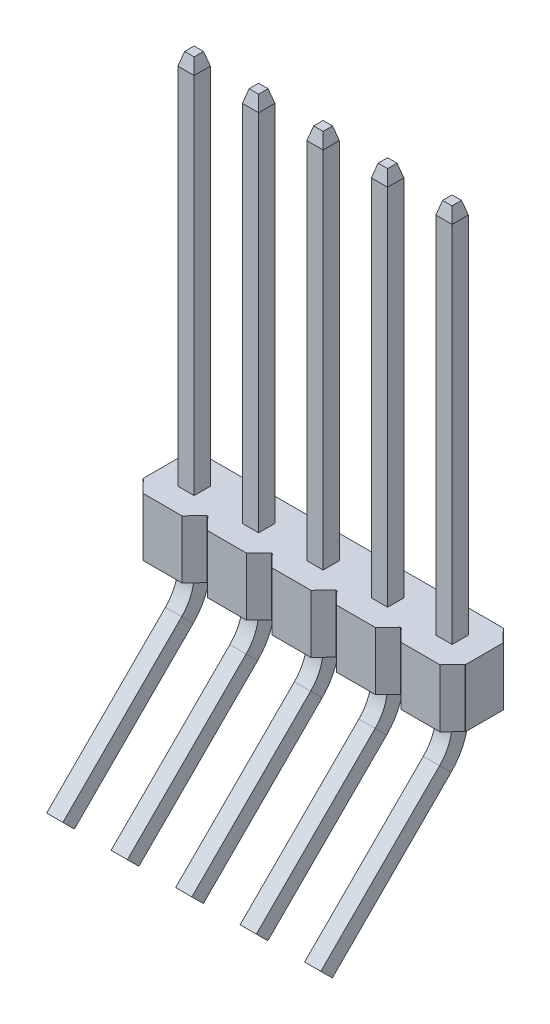
from build123d import *
from OCP.BRepFilletAPI import BRepFilletAPI_MakeChamfer

# Parameters (mm, degrees)
BOSS_EXTRUDE1_DEPTH         = 2.29
SKETCH3_W                   = 0.64
SKETCH3_H                   = 0.64
CHAMFER3_SIZE               = 0.5
CHAMFER3_SIZE2              = 0.133974596
LPATTERN1_COUNT             = 5
LPATTERN1_PITCH             = 2.54
CHAMFER3_OF_LPATTERN1_SIZE  = 0.5
CHAMFER3_OF_LPATTERN1_SIZE2 = 0.133974596


with BuildPart() as part:
    # Sketch1 → Boss-Extrude1 (new body)
    with BuildSketch(Plane(origin=(0, 0, 0), x_dir=(1, 0, 0), z_dir=(0, 1, 0))):
        Polygon((-0.77, 1.25), (0.77, 1.25), (1.25, 0.75), (1.27, 0.75), (1.27, -0.75), (1.25, -0.75), (0.77, -1.25), (-0.77, -1.25), (-1.25, -0.75), (-1.27, -0.75), (-1.27, 0.75), (-1.25, 0.75), align=None)
    boss_extrude1 = extrude(amount=BOSS_EXTRUDE1_DEPTH)

    # Sweep1: sweep along a path in Sketch2
    with BuildLine(Plane(origin=(0, 0, 0), x_dir=(0, 0, -1), z_dir=(1, 0, 0))) as sweep1_path:
        Line((0, 17.12), (0, -0.408142235))
        ThreePointArc((0, -0.408142235), (-0.152240935, -1.1735091), (-0.585786438, -1.822355798))
        Line((-0.585786438, -1.822355798), (-5.26343064, -6.5))
    # Sketch3 → Sweep1 (sweep)
    with BuildSketch(Plane(origin=(0, 17.12, 0), x_dir=(1, 0, 0), z_dir=(0, 1, 0))):
        Rectangle(SKETCH3_W, SKETCH3_H)
    sweep1 = sweep(path=sweep1_path.line)

    # Chamfer3: one chamfer whose edges measure the first distance from different faces: ONE call of the kernel's chamfer builder (chamfer() names one face for all edges)
    chamfer3_edges_1 = [part.edges().sort_by_distance(p)[0] for p in [
        (0.32, 17.12, 0),
    ]]
    chamfer3_side_1 = [part.faces().sort_by_distance(p)[0] for p in [
        (0.32, 9.705, 0),
    ]]
    chamfer3_edges_2 = [part.edges().sort_by_distance(p)[0] for p in [
        (0, 17.12, -0.32),
    ]]
    chamfer3_side_2 = [part.faces().sort_by_distance(p)[0] for p in [
        (0, 9.705, -0.32),
    ]]
    chamfer3_edges_3 = [part.edges().sort_by_distance(p)[0] for p in [
        (-0.32, 17.12, 0),
    ]]
    chamfer3_side_3 = [part.faces().sort_by_distance(p)[0] for p in [
        (-0.32, 9.705, 0),
    ]]
    chamfer3_edges_4 = [part.edges().sort_by_distance(p)[0] for p in [
        (0, 17.12, 0.32),
    ]]
    chamfer3_side_4 = [part.faces().sort_by_distance(p)[0] for p in [
        (0, 9.705, 0.32),
    ]]
    chamfer3 = BRepFilletAPI_MakeChamfer(part.part.solid().wrapped)
    for e in chamfer3_edges_1:
        chamfer3.Add(CHAMFER3_SIZE, CHAMFER3_SIZE2, e.wrapped, chamfer3_side_1[0].wrapped)  # the first distance lies on this face
    for e in chamfer3_edges_2:
        chamfer3.Add(CHAMFER3_SIZE, CHAMFER3_SIZE2, e.wrapped, chamfer3_side_2[0].wrapped)  # the first distance lies on this face
    for e in chamfer3_edges_3:
        chamfer3.Add(CHAMFER3_SIZE, CHAMFER3_SIZE2, e.wrapped, chamfer3_side_3[0].wrapped)  # the first distance lies on this face
    for e in chamfer3_edges_4:
        chamfer3.Add(CHAMFER3_SIZE, CHAMFER3_SIZE2, e.wrapped, chamfer3_side_4[0].wrapped)  # the first distance lies on this face
    add(Compound.cast(chamfer3.Shape()), mode=Mode.REPLACE)

    # LPattern1: Boss-Extrude1, Sweep1 ×5
    with Locations(*[(i * LPATTERN1_PITCH, 0, 0) for i in range(1, LPATTERN1_COUNT)]):
        add(boss_extrude1)
        add(sweep1)

    # Chamfer3 of LPattern1: one chamfer whose edges measure the first distance from different faces: ONE call of the kernel's chamfer builder (chamfer() names one face for all edges)
    chamfer3_of_lpattern1_edges_1 = [part.edges().sort_by_distance(p)[0] for p in [
        (2.86, 17.12, 0),
    ]]
    chamfer3_of_lpattern1_side_1 = [part.faces().sort_by_distance(p)[0] for p in [
        (2.86, 9.705, 0),
    ]]
    chamfer3_of_lpattern1_edges_2 = [part.edges().sort_by_distance(p)[0] for p in [
        (2.54, 17.12, -0.32),
    ]]
    chamfer3_of_lpattern1_side_2 = [part.faces().sort_by_distance(p)[0] for p in [
        (2.54, 9.705, -0.32),
    ]]
    chamfer3_of_lpattern1_edges_3 = [part.edges().sort_by_distance(p)[0] for p in [
        (2.22, 17.12, 0),
    ]]
    chamfer3_of_lpattern1_side_3 = [part.faces().sort_by_distance(p)[0] for p in [
        (2.22, 9.705, 0),
    ]]
    chamfer3_of_lpattern1_edges_4 = [part.edges().sort_by_distance(p)[0] for p in [
        (2.54, 17.12, 0.32),
    ]]
    chamfer3_of_lpattern1_side_4 = [part.faces().sort_by_distance(p)[0] for p in [
        (2.54, 9.705, 0.32),
    ]]
    chamfer3_of_lpattern1_edges_5 = [part.edges().sort_by_distance(p)[0] for p in [
        (5.4, 17.12, 0),
    ]]
    chamfer3_of_lpattern1_side_5 = [part.faces().sort_by_distance(p)[0] for p in [
        (5.4, 9.705, 0),
    ]]
    chamfer3_of_lpattern1_edges_6 = [part.edges().sort_by_distance(p)[0] for p in [
        (5.08, 17.12, -0.32),
    ]]
    chamfer3_of_lpattern1_side_6 = [part.faces().sort_by_distance(p)[0] for p in [
        (5.08, 9.705, -0.32),
    ]]
    chamfer3_of_lpattern1_edges_7 = [part.edges().sort_by_distance(p)[0] for p in [
        (4.76, 17.12, 0),
    ]]
    chamfer3_of_lpattern1_side_7 = [part.faces().sort_by_distance(p)[0] for p in [
        (4.76, 9.705, 0),
    ]]
    chamfer3_of_lpattern1_edges_8 = [part.edges().sort_by_distance(p)[0] for p in [
        (5.08, 17.12, 0.32),
    ]]
    chamfer3_of_lpattern1_side_8 = [part.faces().sort_by_distance(p)[0] for p in [
        (5.08, 9.705, 0.32),
    ]]
    chamfer3_of_lpattern1_edges_9 = [part.edges().sort_by_distance(p)[0] for p in [
        (7.94, 17.12, 0),
    ]]
    chamfer3_of_lpattern1_side_9 = [part.faces().sort_by_distance(p)[0] for p in [
        (7.94, 9.705, 0),
    ]]
    chamfer3_of_lpattern1_edges_10 = [part.edges().sort_by_distance(p)[0] for p in [
        (7.62, 17.12, -0.32),
    ]]
    chamfer3_of_lpattern1_side_10 = [part.faces().sort_by_distance(p)[0] for p in [
        (7.62, 9.705, -0.32),
    ]]
    chamfer3_of_lpattern1_edges_11 = [part.edges().sort_by_distance(p)[0] for p in [
        (7.3, 17.12, 0),
    ]]
    chamfer3_of_lpattern1_side_11 = [part.faces().sort_by_distance(p)[0] for p in [
        (7.3, 9.705, 0),
    ]]
    chamfer3_of_lpattern1_edges_12 = [part.edges().sort_by_distance(p)[0] for p in [
        (7.62, 17.12, 0.32),
    ]]
    chamfer3_of_lpattern1_side_12 = [part.faces().sort_by_distance(p)[0] for p in [
        (7.62, 9.705, 0.32),
    ]]
    chamfer3_of_lpattern1_edges_13 = [part.edges().sort_by_distance(p)[0] for p in [
        (10.48, 17.12, 0),
    ]]
    chamfer3_of_lpattern1_side_13 = [part.faces().sort_by_distance(p)[0] for p in [
        (10.48, 9.705, 0),
    ]]
    chamfer3_of_lpattern1_edges_14 = [part.edges().sort_by_distance(p)[0] for p in [
        (10.16, 17.12, -0.32),
    ]]
    chamfer3_of_lpattern1_side_14 = [part.faces().sort_by_distance(p)[0] for p in [
        (10.16, 9.705, -0.32),
    ]]
    chamfer3_of_lpattern1_edges_15 = [part.edges().sort_by_distance(p)[0] for p in [
        (9.84, 17.12, 0),
    ]]
    chamfer3_of_lpattern1_side_15 = [part.faces().sort_by_distance(p)[0] for p in [
        (9.84, 9.705, 0),
    ]]
    chamfer3_of_lpattern1_edges_16 = [part.edges().sort_by_distance(p)[0] for p in [
        (10.16, 17.12, 0.32),
    ]]
    chamfer3_of_lpattern1_side_16 = [part.faces().sort_by_distance(p)[0] for p in [
        (10.16, 9.705, 0.32),
    ]]
    chamfer3_of_lpattern1 = BRepFilletAPI_MakeChamfer(part.part.solid().wrapped)
    for e in chamfer3_of_lpattern1_edges_1:
        chamfer3_of_lpattern1.Add(CHAMFER3_OF_LPATTERN1_SIZE, CHAMFER3_OF_LPATTERN1_SIZE2, e.wrapped, chamfer3_of_lpattern1_side_1[0].wrapped)  # the first distance lies on this face
    for e in chamfer3_of_lpattern1_edges_2:
        chamfer3_of_lpattern1.Add(CHAMFER3_OF_LPATTERN1_SIZE, CHAMFER3_OF_LPATTERN1_SIZE2, e.wrapped, chamfer3_of_lpattern1_side_2[0].wrapped)  # the first distance lies on this face
    for e in chamfer3_of_lpattern1_edges_3:
        chamfer3_of_lpattern1.Add(CHAMFER3_OF_LPATTERN1_SIZE, CHAMFER3_OF_LPATTERN1_SIZE2, e.wrapped, chamfer3_of_lpattern1_side_3[0].wrapped)  # the first distance lies on this face
    for e in chamfer3_of_lpattern1_edges_4:
        chamfer3_of_lpattern1.Add(CHAMFER3_OF_LPATTERN1_SIZE, CHAMFER3_OF_LPATTERN1_SIZE2, e.wrapped, chamfer3_of_lpattern1_side_4[0].wrapped)  # the first distance lies on this face
    for e in chamfer3_of_lpattern1_edges_5:
        chamfer3_of_lpattern1.Add(CHAMFER3_OF_LPATTERN1_SIZE, CHAMFER3_OF_LPATTERN1_SIZE2, e.wrapped, chamfer3_of_lpattern1_side_5[0].wrapped)  # the first distance lies on this face
    for e in chamfer3_of_lpattern1_edges_6:
        chamfer3_of_lpattern1.Add(CHAMFER3_OF_LPATTERN1_SIZE, CHAMFER3_OF_LPATTERN1_SIZE2, e.wrapped, chamfer3_of_lpattern1_side_6[0].wrapped)  # the first distance lies on this face
    for e in chamfer3_of_lpattern1_edges_7:
        chamfer3_of_lpattern1.Add(CHAMFER3_OF_LPATTERN1_SIZE, CHAMFER3_OF_LPATTERN1_SIZE2, e.wrapped, chamfer3_of_lpattern1_side_7[0].wrapped)  # the first distance lies on this face
    for e in chamfer3_of_lpattern1_edges_8:
        chamfer3_of_lpattern1.Add(CHAMFER3_OF_LPATTERN1_SIZE, CHAMFER3_OF_LPATTERN1_SIZE2, e.wrapped, chamfer3_of_lpattern1_side_8[0].wrapped)  # the first distance lies on this face
    for e in chamfer3_of_lpattern1_edges_9:
        chamfer3_of_lpattern1.Add(CHAMFER3_OF_LPATTERN1_SIZE, CHAMFER3_OF_LPATTERN1_SIZE2, e.wrapped, chamfer3_of_lpattern1_side_9[0].wrapped)  # the first distance lies on this face
    for e in chamfer3_of_lpattern1_edges_10:
        chamfer3_of_lpattern1.Add(CHAMFER3_OF_LPATTERN1_SIZE, CHAMFER3_OF_LPATTERN1_SIZE2, e.wrapped, chamfer3_of_lpattern1_side_10[0].wrapped)  # the first distance lies on this face
    for e in chamfer3_of_lpattern1_edges_11:
        chamfer3_of_lpattern1.Add(CHAMFER3_OF_LPATTERN1_SIZE, CHAMFER3_OF_LPATTERN1_SIZE2, e.wrapped, chamfer3_of_lpattern1_side_11[0].wrapped)  # the first distance lies on this face
    for e in chamfer3_of_lpattern1_edges_12:
        chamfer3_of_lpattern1.Add(CHAMFER3_OF_LPATTERN1_SIZE, CHAMFER3_OF_LPATTERN1_SIZE2, e.wrapped, chamfer3_of_lpattern1_side_12[0].wrapped)  # the first distance lies on this face
    for e in chamfer3_of_lpattern1_edges_13:
        chamfer3_of_lpattern1.Add(CHAMFER3_OF_LPATTERN1_SIZE, CHAMFER3_OF_LPATTERN1_SIZE2, e.wrapped, chamfer3_of_lpattern1_side_13[0].wrapped)  # the first distance lies on this face
    for e in chamfer3_of_lpattern1_edges_14:
        chamfer3_of_lpattern1.Add(CHAMFER3_OF_LPATTERN1_SIZE, CHAMFER3_OF_LPATTERN1_SIZE2, e.wrapped, chamfer3_of_lpattern1_side_14[0].wrapped)  # the first distance lies on this face
    for e in chamfer3_of_lpattern1_edges_15:
        chamfer3_of_lpattern1.Add(CHAMFER3_OF_LPATTERN1_SIZE, CHAMFER3_OF_LPATTERN1_SIZE2, e.wrapped, chamfer3_of_lpattern1_side_15[0].wrapped)  # the first distance lies on this face
    for e in chamfer3_of_lpattern1_edges_16:
        chamfer3_of_lpattern1.Add(CHAMFER3_OF_LPATTERN1_SIZE, CHAMFER3_OF_LPATTERN1_SIZE2, e.wrapped, chamfer3_of_lpattern1_side_16[0].wrapped)  # the first distance lies on this face
    add(Compound.cast(chamfer3_of_lpattern1.Shape()), mode=Mode.REPLACE)


solid = part.part
